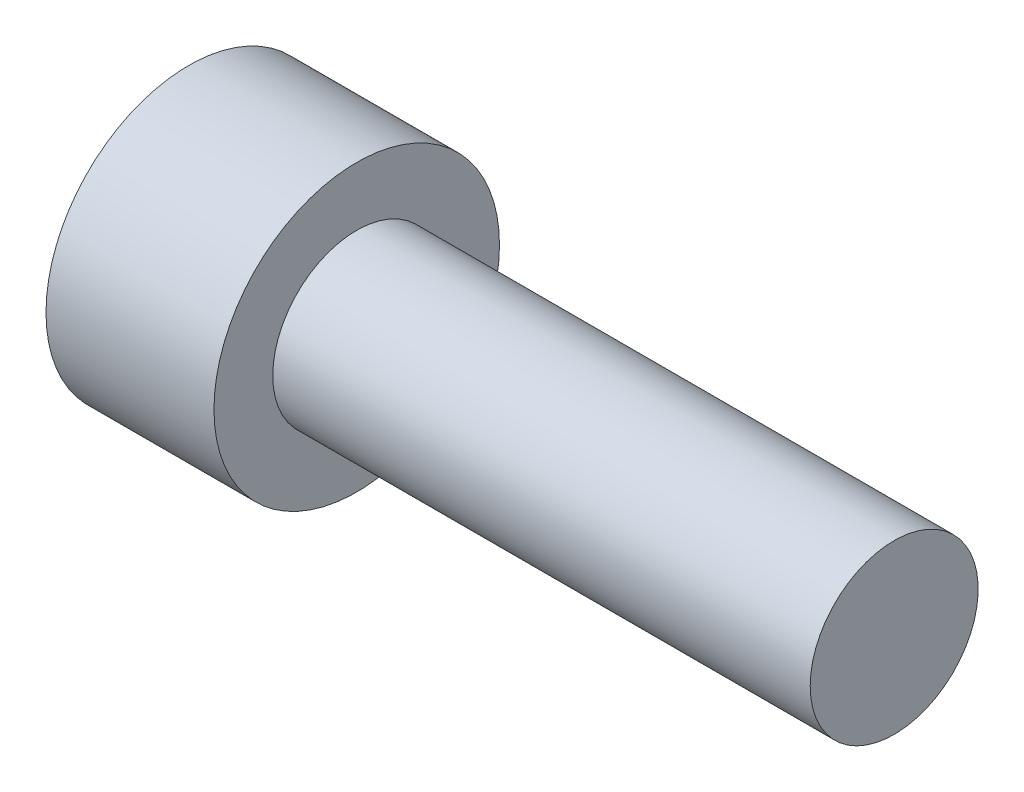
from build123d import *

# Parameters (mm, degrees)
CUT_EXTRUDE1_DEPTH = 2.5


with BuildPart() as part:
    # Sketch1 → Revolve1 (revolve)
    with BuildSketch(Plane.XY, mode=Mode.PRIVATE) as revolve1_sk:
        Polygon((0, 0), (0, 4.25), (5, 4.25), (5, 2.5), (21, 2.5), (21, 0), align=None)
    revolve(revolve1_sk.sketch.rotate(Axis((0, 0, 0), (1, 0, 0)), 90), axis=Axis((0, 0, 0), (1, 0, 0)))

    # Sketch2 → Cut-Revolve1 (revolve, cut)
    with BuildSketch(Plane.XY, mode=Mode.PRIVATE) as cut_revolve1_sk:
        Polygon((0, 2), (2.5, 2), (3.654700538, 0), (0, 0), align=None)
    revolve(cut_revolve1_sk.sketch.rotate(Axis((0, 0, 0), (1, 0, 0)), 180), axis=Axis((0, 0, 0), (1, 0, 0)), mode=Mode.SUBTRACT)

    # Sketch3 → Cut-Extrude1 (cut)
    with BuildSketch(Plane.ZY):
        Polygon((0, -2.309401077), (2, -1.154700538), (2, 1.154700538), (0, 2.309401077), (-2, 1.154700538), (-2, -1.154700538), align=None)
    extrude(amount=-CUT_EXTRUDE1_DEPTH, mode=Mode.SUBTRACT)


solid = part.part
